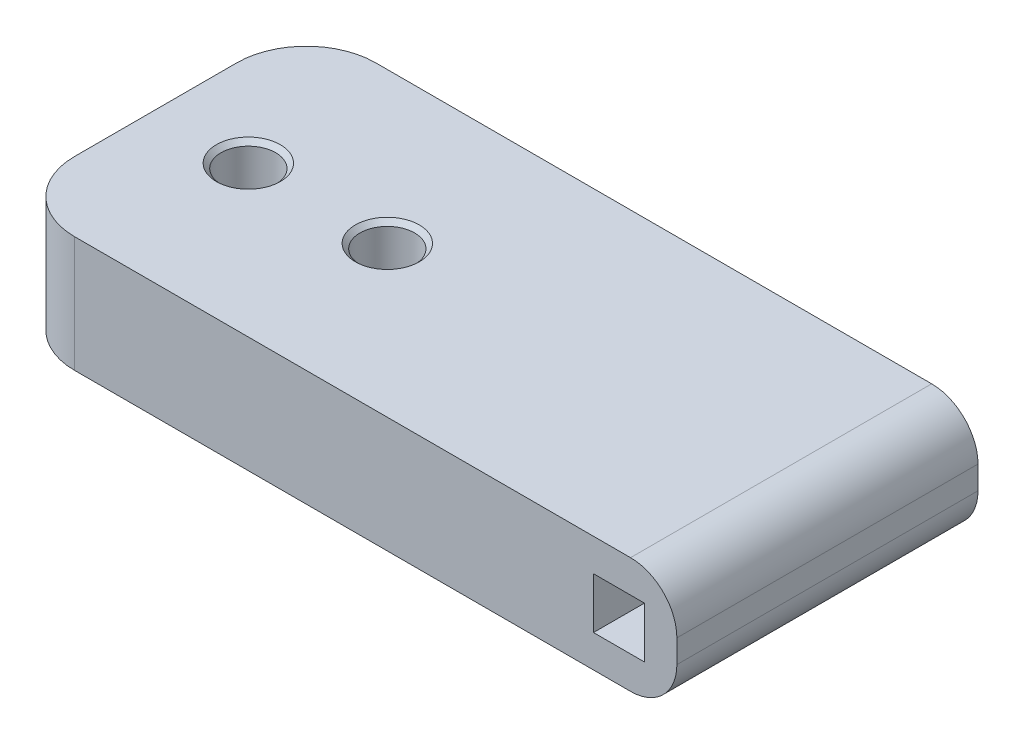
from build123d import *

# Parameters (mm, degrees)
SKETCH1_W             = 36.83
SKETCH1_H             = 16.51
BOSS_EXTRUDE1_DEPTH   = 6.35
F_3_0MM_DOWEL_HOLE1_D = 3
CHAMFER1_SIZE         = 0.254
FILLET2_R             = 3.81
SKETCH24_W            = 2.794
SKETCH24_H            = 2.794
CUT_EXTRUDE7_DEPTH    = 5.08
SKETCH25_W            = 2.794
SKETCH25_H            = 2.794
CUT_EXTRUDE8_DEPTH    = 5.08
FILLET7_R             = 2.54


with BuildPart() as part:
    # Sketch1 → Boss-Extrude1 (new body)
    with BuildSketch(Plane(origin=(0, 0, 0), x_dir=(1, 0, 0), z_dir=(0, 1, 0))):
        with Locations((18.415, 8.255)):
            Rectangle(SKETCH1_W, SKETCH1_H)
    extrude(amount=BOSS_EXTRUDE1_DEPTH)

    # Ø3.0mm Dowel Hole1 (through all)
    with Locations(Plane(origin=(0, 6.35, 0), x_dir=(1, 0, 0), z_dir=(0, 1, 0))):
        with Locations((5.08, 8.255), (12.7, 8.255)):
            Hole(F_3_0MM_DOWEL_HOLE1_D / 2)

    # Chamfer1
    chamfer1_edges = [part.edges().sort_by_distance(p)[0] for p in [
        (14.2, 6.35, -8.255),
        (14.2, 0, -8.255),
        (6.58, 6.35, -8.255),
        (6.58, 0, -8.255),
    ]]
    chamfer(chamfer1_edges, length=CHAMFER1_SIZE)

    # Fillet2
    fillet2_edges = [part.edges().sort_by_distance(p)[0] for p in [
        (0, 3.175, -16.51),
        (0, 3.175, 0),
    ]]
    fillet(fillet2_edges, radius=FILLET2_R)

    # Sketch24 → Cut-Extrude7 (cut)
    with BuildSketch(Plane.XY):
        with Locations((33.655, 3.175)):
            Rectangle(SKETCH24_W, SKETCH24_H)
    extrude(amount=-CUT_EXTRUDE7_DEPTH, mode=Mode.SUBTRACT)

    # Sketch25 → Cut-Extrude8 (cut)
    with BuildSketch(Plane(origin=(0, 0, -16.51), x_dir=(-1, 0, 0), z_dir=(0, 0, -1))):
        with Locations((-33.655, 3.175)):
            Rectangle(SKETCH25_W, SKETCH25_H)
    extrude(amount=-CUT_EXTRUDE8_DEPTH, mode=Mode.SUBTRACT)

    # Fillet7
    fillet7_edges = [part.edges().sort_by_distance(p)[0] for p in [
        (36.83, 6.35, -8.255),
        (36.83, 0, -8.255),
    ]]
    fillet(fillet7_edges, radius=FILLET7_R)


solid = part.part
